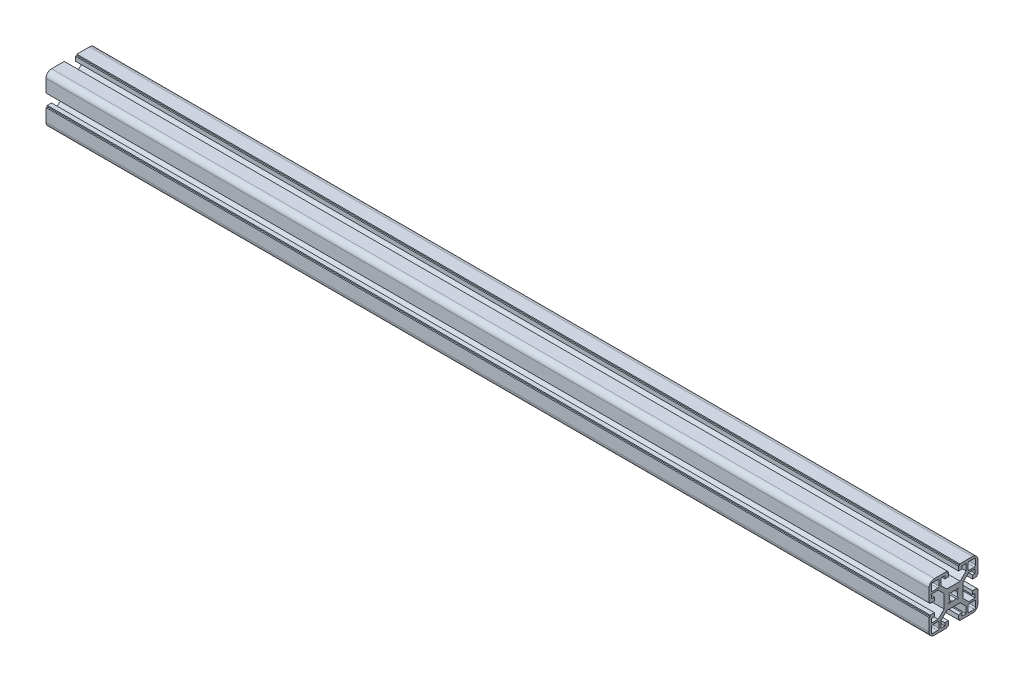
from build123d import *

# Parameters (mm, degrees)
EXTRUDE_1_DEPTH = 50
EXTRUDE_2_DEPTH = 720


with BuildPart() as part:
    # 草图1 → 凸台-拉伸1 (new body)
    with BuildSketch(Plane(origin=(0, 0, 0), x_dir=(0, 0, -1), z_dir=(1, 0, 0))):
        with BuildLine():
            Line((4.82004008, 19.27995992), (3.82004008, 19.27995992))
            Line((3.82004008, 19.27995992), (3.82004008, 15.77995992))
            Line((3.82004008, 15.77995992), (6.73639159, 15.77995992))
            Line((6.73639159, 15.77995992), (6.73639159, 18.02995992))
            Line((6.73639159, 18.02995992), (10.02004008, 18.02995992))
            Line((10.02004008, 18.02995992), (10.02004008, 12.70128026))
            Line((10.02004008, 12.70128026), (5.19871974, 7.87995992))
            Line((5.19871974, 7.87995992), (-5.75863958, 7.87995992))
            Line((-5.75863958, 7.87995992), (-10.57995992, 12.70128026))
            Line((-10.57995992, 12.70128026), (-10.57995992, 18.02995992))
            Line((-10.57995992, 18.02995992), (-7.29631143, 18.02995992))
            Line((-7.29631143, 18.02995992), (-7.29631143, 15.77995992))
            Line((-7.29631143, 15.77995992), (-4.37995992, 15.77995992))
            Line((-4.37995992, 15.77995992), (-4.37995992, 19.27995992))
            Line((-4.37995992, 19.27995992), (-5.37995992, 19.27995992))
            Line((-5.37995992, 19.27995992), (-5.37995992, 20.27995992))
            Line((-5.37995992, 20.27995992), (-15.77995992, 20.27995992))
            ThreePointArc((-15.77995992, 20.27995992), (-18.961940435, 18.961940435), (-20.27995992, 15.77995992))
            Line((-20.27995992, 15.77995992), (-20.27995992, 5.37995992))
            Line((-20.27995992, 5.37995992), (-19.27995992, 5.37995992))
            Line((-19.27995992, 5.37995992), (-19.27995992, 4.37995992))
            Line((-19.27995992, 4.37995992), (-15.77995992, 4.37995992))
            Line((-15.77995992, 4.37995992), (-15.77995992, 7.29631143))
            Line((-15.77995992, 7.29631143), (-18.02995992, 7.29631143))
            Line((-18.02995992, 7.29631143), (-18.02995992, 10.57995992))
            Line((-18.02995992, 10.57995992), (-12.70128026, 10.57995992))
            Line((-12.70128026, 10.57995992), (-7.87995992, 5.75863958))
            Line((-7.87995992, 5.75863958), (-7.87995992, -5.19871974))
            Line((-7.87995992, -5.19871974), (-12.70128026, -10.02004008))
            Line((-12.70128026, -10.02004008), (-18.02995992, -10.02004008))
            Line((-18.02995992, -10.02004008), (-18.02995992, -6.73639159))
            Line((-18.02995992, -6.73639159), (-15.77995992, -6.73639159))
            Line((-15.77995992, -6.73639159), (-15.77995992, -3.82004008))
            Line((-15.77995992, -3.82004008), (-19.27995992, -3.82004008))
            Line((-19.27995992, -3.82004008), (-19.27995992, -4.82004008))
            Line((-19.27995992, -4.82004008), (-20.27995992, -4.82004008))
            Line((-20.27995992, -4.82004008), (-20.27995992, -15.22004008))
            ThreePointArc((-20.27995992, -15.22004008), (-18.961940435, -18.402020595), (-15.77995992, -19.72004008))
            Line((-15.77995992, -19.72004008), (-5.37995992, -19.72004008))
            Line((-5.37995992, -19.72004008), (-5.37995992, -18.72004008))
            Line((-5.37995992, -18.72004008), (-4.37995992, -18.72004008))
            Line((-4.37995992, -18.72004008), (-4.37995992, -15.22004008))
            Line((-4.37995992, -15.22004008), (-7.29631143, -15.22004008))
            Line((-7.29631143, -15.22004008), (-7.29631143, -17.47004008))
            Line((-7.29631143, -17.47004008), (-10.57995992, -17.47004008))
            Line((-10.57995992, -17.47004008), (-10.57995992, -12.14136042))
            Line((-10.57995992, -12.14136042), (-5.75863958, -7.32004008))
            Line((-5.75863958, -7.32004008), (5.19871974, -7.32004008))
            Line((5.19871974, -7.32004008), (10.02004008, -12.14136042))
            Line((10.02004008, -12.14136042), (10.02004008, -17.47004008))
            Line((10.02004008, -17.47004008), (6.73639159, -17.47004008))
            Line((6.73639159, -17.47004008), (6.73639159, -15.22004008))
            Line((6.73639159, -15.22004008), (3.82004008, -15.22004008))
            Line((3.82004008, -15.22004008), (3.82004008, -18.72004008))
            Line((3.82004008, -18.72004008), (4.82004008, -18.72004008))
            Line((4.82004008, -18.72004008), (4.82004008, -19.72004008))
            Line((4.82004008, -19.72004008), (15.22004008, -19.72004008))
            ThreePointArc((15.22004008, -19.72004008), (18.402020595, -18.402020595), (19.72004008, -15.22004008))
            Line((19.72004008, -15.22004008), (19.72004008, -4.82004008))
            Line((19.72004008, -4.82004008), (18.72004008, -4.82004008))
            Line((18.72004008, -4.82004008), (18.72004008, -3.82004008))
            Line((18.72004008, -3.82004008), (15.22004008, -3.82004008))
            Line((15.22004008, -3.82004008), (15.22004008, -6.73639159))
            Line((15.22004008, -6.73639159), (17.47004008, -6.73639159))
            Line((17.47004008, -6.73639159), (17.47004008, -10.02004008))
            Line((17.47004008, -10.02004008), (12.14136042, -10.02004008))
            Line((12.14136042, -10.02004008), (7.32004008, -5.19871974))
            Line((7.32004008, -5.19871974), (7.32004008, 5.75863958))
            Line((7.32004008, 5.75863958), (12.14136042, 10.57995992))
            Line((12.14136042, 10.57995992), (17.47004008, 10.57995992))
            Line((17.47004008, 10.57995992), (17.47004008, 7.29631143))
            Line((17.47004008, 7.29631143), (15.22004008, 7.29631143))
            Line((15.22004008, 7.29631143), (15.22004008, 4.37995992))
            Line((15.22004008, 4.37995992), (18.72004008, 4.37995992))
            Line((18.72004008, 4.37995992), (18.72004008, 5.37995992))
            Line((18.72004008, 5.37995992), (19.72004008, 5.37995992))
            Line((19.72004008, 5.37995992), (19.72004008, 15.77995992))
            ThreePointArc((19.72004008, 15.77995992), (18.402020595, 18.961940435), (15.22004008, 20.27995992))
            Line((15.22004008, 20.27995992), (4.82004008, 20.27995992))
            Line((4.82004008, 20.27995992), (4.82004008, 19.27995992))
        make_face()
        with BuildLine():
            Line((-13.07995992, -17.72004008), (-17.27995992, -17.72004008))
            ThreePointArc((-17.27995992, -17.72004008), (-17.987066701, -17.427146861), (-18.27995992, -16.72004008))
            Line((-18.27995992, -16.72004008), (-18.27995992, -12.52004008))
            ThreePointArc((-18.27995992, -12.52004008), (-17.987066701, -11.812933299), (-17.27995992, -11.52004008))
            Line((-17.27995992, -11.52004008), (-13.07995992, -11.52004008))
            ThreePointArc((-13.07995992, -11.52004008), (-12.372853139, -11.812933299), (-12.07995992, -12.52004008))
            Line((-12.07995992, -12.52004008), (-12.07995992, -16.72004008))
            ThreePointArc((-12.07995992, -16.72004008), (-12.372853139, -17.427146861), (-13.07995992, -17.72004008))
        make_face(mode=Mode.SUBTRACT)
        with BuildLine():
            Line((-17.27995992, 18.27995992), (-13.07995992, 18.27995992))
            ThreePointArc((-13.07995992, 18.27995992), (-12.372853139, 17.987066701), (-12.07995992, 17.27995992))
            Line((-12.07995992, 17.27995992), (-12.07995992, 13.07995992))
            ThreePointArc((-12.07995992, 13.07995992), (-12.372853139, 12.372853139), (-13.07995992, 12.07995992))
            Line((-13.07995992, 12.07995992), (-17.27995992, 12.07995992))
            ThreePointArc((-17.27995992, 12.07995992), (-17.987066701, 12.372853139), (-18.27995992, 13.07995992))
            Line((-18.27995992, 13.07995992), (-18.27995992, 17.27995992))
            ThreePointArc((-18.27995992, 17.27995992), (-17.987066701, 17.987066701), (-17.27995992, 18.27995992))
        make_face(mode=Mode.SUBTRACT)
        with BuildLine():
            Line((16.72004008, 12.07995992), (12.52004008, 12.07995992))
            ThreePointArc((12.52004008, 12.07995992), (11.812933299, 12.372853139), (11.52004008, 13.07995992))
            Line((11.52004008, 13.07995992), (11.52004008, 17.27995992))
            ThreePointArc((11.52004008, 17.27995992), (11.812933299, 17.987066701), (12.52004008, 18.27995992))
            Line((12.52004008, 18.27995992), (16.72004008, 18.27995992))
            ThreePointArc((16.72004008, 18.27995992), (17.427146861, 17.987066701), (17.72004008, 17.27995992))
            Line((17.72004008, 17.27995992), (17.72004008, 13.07995992))
            ThreePointArc((17.72004008, 13.07995992), (17.427146861, 12.372853139), (16.72004008, 12.07995992))
        make_face(mode=Mode.SUBTRACT)
        with BuildLine():
            Line((3.75045895, -3.04335217), (3.04335217, -3.75045895))
            Line((3.04335217, -3.75045895), (1.74451108, -2.45161786))
            ThreePointArc((1.74451108, -2.45161786), (-0.27995992, -3.12004008), (-2.30443092, -2.45161786))
            Line((-2.30443092, -2.45161786), (-3.60327201, -3.75045895))
            Line((-3.60327201, -3.75045895), (-4.31037879, -3.04335217))
            Line((-4.31037879, -3.04335217), (-3.0115377, -1.74451108))
            ThreePointArc((-3.0115377, -1.74451108), (-3.67995992, 0.27995992), (-3.0115377, 2.30443092))
            Line((-3.0115377, 2.30443092), (-4.31037879, 3.60327201))
            Line((-4.31037879, 3.60327201), (-3.60327201, 4.31037879))
            Line((-3.60327201, 4.31037879), (-2.30443092, 3.0115377))
            ThreePointArc((-2.30443092, 3.0115377), (-0.27995992, 3.67995992), (1.74451108, 3.0115377))
            Line((1.74451108, 3.0115377), (3.04335217, 4.31037879))
            Line((3.04335217, 4.31037879), (3.75045895, 3.60327201))
            Line((3.75045895, 3.60327201), (2.45161786, 2.30443092))
            ThreePointArc((2.45161786, 2.30443092), (3.12004008, 0.27995992), (2.45161786, -1.74451108))
            Line((2.45161786, -1.74451108), (3.75045895, -3.04335217))
        make_face(mode=Mode.SUBTRACT)
        with BuildLine():
            Line((17.72004008, -12.52004008), (17.72004008, -16.72004008))
            ThreePointArc((17.72004008, -16.72004008), (17.427146861, -17.427146861), (16.72004008, -17.72004008))
            Line((16.72004008, -17.72004008), (12.52004008, -17.72004008))
            ThreePointArc((12.52004008, -17.72004008), (11.812933299, -17.427146861), (11.52004008, -16.72004008))
            Line((11.52004008, -16.72004008), (11.52004008, -12.52004008))
            ThreePointArc((11.52004008, -12.52004008), (11.812933299, -11.812933299), (12.52004008, -11.52004008))
            Line((12.52004008, -11.52004008), (16.72004008, -11.52004008))
            ThreePointArc((16.72004008, -11.52004008), (17.427146861, -11.812933299), (17.72004008, -12.52004008))
        make_face(mode=Mode.SUBTRACT)
    extrude(amount=-EXTRUDE_1_DEPTH)

    # 草图2 → 凸台-拉伸2 (add)
    with BuildSketch(Plane(origin=(0, 0, 0), x_dir=(0, 0, -1), z_dir=(1, 0, 0))):
        with BuildLine():
            Line((19.72004008, 5.37995992), (19.72004008, 15.77995992))
            ThreePointArc((19.72004008, 15.77995992), (18.402020595, 18.961940435), (15.22004008, 20.27995992))
            Line((15.22004008, 20.27995992), (4.82004008, 20.27995992))
            Line((4.82004008, 20.27995992), (4.82004008, 19.27995992))
            Line((4.82004008, 19.27995992), (3.82004008, 19.27995992))
            Line((3.82004008, 19.27995992), (3.82004008, 15.77995992))
            Line((3.82004008, 15.77995992), (6.73639159, 15.77995992))
            Line((6.73639159, 15.77995992), (6.73639159, 18.02995992))
            Line((6.73639159, 18.02995992), (10.02004008, 18.02995992))
            Line((10.02004008, 18.02995992), (10.02004008, 12.70128026))
            Line((10.02004008, 12.70128026), (5.19871974, 7.87995992))
            Line((5.19871974, 7.87995992), (-5.75863958, 7.87995992))
            Line((-5.75863958, 7.87995992), (-10.57995992, 12.70128026))
            Line((-10.57995992, 12.70128026), (-10.57995992, 18.02995992))
            Line((-10.57995992, 18.02995992), (-7.29631143, 18.02995992))
            Line((-7.29631143, 18.02995992), (-7.29631143, 15.77995992))
            Line((-7.29631143, 15.77995992), (-4.37995992, 15.77995992))
            Line((-4.37995992, 15.77995992), (-4.37995992, 19.27995992))
            Line((-4.37995992, 19.27995992), (-5.37995992, 19.27995992))
            Line((-5.37995992, 19.27995992), (-5.37995992, 20.27995992))
            Line((-5.37995992, 20.27995992), (-15.77995992, 20.27995992))
            ThreePointArc((-15.77995992, 20.27995992), (-18.961940435, 18.961940435), (-20.27995992, 15.77995992))
            Line((-20.27995992, 15.77995992), (-20.27995992, 5.37995992))
            Line((-20.27995992, 5.37995992), (-19.27995992, 5.37995992))
            Line((-19.27995992, 5.37995992), (-19.27995992, 4.37995992))
            Line((-19.27995992, 4.37995992), (-15.77995992, 4.37995992))
            Line((-15.77995992, 4.37995992), (-15.77995992, 7.29631143))
            Line((-15.77995992, 7.29631143), (-18.02995992, 7.29631143))
            Line((-18.02995992, 7.29631143), (-18.02995992, 10.57995992))
            Line((-18.02995992, 10.57995992), (-12.70128026, 10.57995992))
            Line((-12.70128026, 10.57995992), (-7.87995992, 5.75863958))
            Line((-7.87995992, 5.75863958), (-7.87995992, -5.19871974))
            Line((-7.87995992, -5.19871974), (-12.70128026, -10.02004008))
            Line((-12.70128026, -10.02004008), (-18.02995992, -10.02004008))
            Line((-18.02995992, -10.02004008), (-18.02995992, -6.73639159))
            Line((-18.02995992, -6.73639159), (-15.77995992, -6.73639159))
            Line((-15.77995992, -6.73639159), (-15.77995992, -3.82004008))
            Line((-15.77995992, -3.82004008), (-19.27995992, -3.82004008))
            Line((-19.27995992, -3.82004008), (-19.27995992, -4.82004008))
            Line((-19.27995992, -4.82004008), (-20.27995992, -4.82004008))
            Line((-20.27995992, -4.82004008), (-20.27995992, -15.22004008))
            ThreePointArc((-20.27995992, -15.22004008), (-18.961940435, -18.402020595), (-15.77995992, -19.72004008))
            Line((-15.77995992, -19.72004008), (-5.37995992, -19.72004008))
            Line((-5.37995992, -19.72004008), (-5.37995992, -18.72004008))
            Line((-5.37995992, -18.72004008), (-4.37995992, -18.72004008))
            Line((-4.37995992, -18.72004008), (-4.37995992, -15.22004008))
            Line((-4.37995992, -15.22004008), (-7.29631143, -15.22004008))
            Line((-7.29631143, -15.22004008), (-7.29631143, -17.47004008))
            Line((-7.29631143, -17.47004008), (-10.57995992, -17.47004008))
            Line((-10.57995992, -17.47004008), (-10.57995992, -12.14136042))
            Line((-10.57995992, -12.14136042), (-5.75863958, -7.32004008))
            Line((-5.75863958, -7.32004008), (5.19871974, -7.32004008))
            Line((5.19871974, -7.32004008), (10.02004008, -12.14136042))
            Line((10.02004008, -12.14136042), (10.02004008, -17.47004008))
            Line((10.02004008, -17.47004008), (6.73639159, -17.47004008))
            Line((6.73639159, -17.47004008), (6.73639159, -15.22004008))
            Line((6.73639159, -15.22004008), (3.82004008, -15.22004008))
            Line((3.82004008, -15.22004008), (3.82004008, -18.72004008))
            Line((3.82004008, -18.72004008), (4.82004008, -18.72004008))
            Line((4.82004008, -18.72004008), (4.82004008, -19.72004008))
            Line((4.82004008, -19.72004008), (15.22004008, -19.72004008))
            ThreePointArc((15.22004008, -19.72004008), (18.402020595, -18.402020595), (19.72004008, -15.22004008))
            Line((19.72004008, -15.22004008), (19.72004008, -4.82004008))
            Line((19.72004008, -4.82004008), (18.72004008, -4.82004008))
            Line((18.72004008, -4.82004008), (18.72004008, -3.82004008))
            Line((18.72004008, -3.82004008), (15.22004008, -3.82004008))
            Line((15.22004008, -3.82004008), (15.22004008, -6.73639159))
            Line((15.22004008, -6.73639159), (17.47004008, -6.73639159))
            Line((17.47004008, -6.73639159), (17.47004008, -10.02004008))
            Line((17.47004008, -10.02004008), (12.14136042, -10.02004008))
            Line((12.14136042, -10.02004008), (7.32004008, -5.19871974))
            Line((7.32004008, -5.19871974), (7.32004008, 5.75863958))
            Line((7.32004008, 5.75863958), (12.14136042, 10.57995992))
            Line((12.14136042, 10.57995992), (17.47004008, 10.57995992))
            Line((17.47004008, 10.57995992), (17.47004008, 7.29631143))
            Line((17.47004008, 7.29631143), (15.22004008, 7.29631143))
            Line((15.22004008, 7.29631143), (15.22004008, 4.37995992))
            Line((15.22004008, 4.37995992), (18.72004008, 4.37995992))
            Line((18.72004008, 4.37995992), (18.72004008, 5.37995992))
            Line((18.72004008, 5.37995992), (19.72004008, 5.37995992))
        make_face()
        with BuildLine():
            Line((-17.27995992, -17.72004008), (-13.07995992, -17.72004008))
            ThreePointArc((-13.07995992, -17.72004008), (-12.372853139, -17.427146861), (-12.07995992, -16.72004008))
            Line((-12.07995992, -16.72004008), (-12.07995992, -12.52004008))
            ThreePointArc((-12.07995992, -12.52004008), (-12.372853139, -11.812933299), (-13.07995992, -11.52004008))
            Line((-13.07995992, -11.52004008), (-17.27995992, -11.52004008))
            ThreePointArc((-17.27995992, -11.52004008), (-17.987066701, -11.812933299), (-18.27995992, -12.52004008))
            Line((-18.27995992, -12.52004008), (-18.27995992, -16.72004008))
            ThreePointArc((-18.27995992, -16.72004008), (-17.987066701, -17.427146861), (-17.27995992, -17.72004008))
        make_face(mode=Mode.SUBTRACT)
        with BuildLine():
            Line((-13.07995992, 18.27995992), (-17.27995992, 18.27995992))
            ThreePointArc((-17.27995992, 18.27995992), (-17.987066701, 17.987066701), (-18.27995992, 17.27995992))
            Line((-18.27995992, 17.27995992), (-18.27995992, 13.07995992))
            ThreePointArc((-18.27995992, 13.07995992), (-17.987066701, 12.372853139), (-17.27995992, 12.07995992))
            Line((-17.27995992, 12.07995992), (-13.07995992, 12.07995992))
            ThreePointArc((-13.07995992, 12.07995992), (-12.372853139, 12.372853139), (-12.07995992, 13.07995992))
            Line((-12.07995992, 13.07995992), (-12.07995992, 17.27995992))
            ThreePointArc((-12.07995992, 17.27995992), (-12.372853139, 17.987066701), (-13.07995992, 18.27995992))
        make_face(mode=Mode.SUBTRACT)
        with BuildLine():
            Line((11.52004008, 17.27995992), (11.52004008, 13.07995992))
            ThreePointArc((11.52004008, 13.07995992), (11.812933299, 12.372853139), (12.52004008, 12.07995992))
            Line((12.52004008, 12.07995992), (16.72004008, 12.07995992))
            ThreePointArc((16.72004008, 12.07995992), (17.427146861, 12.372853139), (17.72004008, 13.07995992))
            Line((17.72004008, 13.07995992), (17.72004008, 17.27995992))
            ThreePointArc((17.72004008, 17.27995992), (17.427146861, 17.987066701), (16.72004008, 18.27995992))
            Line((16.72004008, 18.27995992), (12.52004008, 18.27995992))
            ThreePointArc((12.52004008, 18.27995992), (11.812933299, 17.987066701), (11.52004008, 17.27995992))
        make_face(mode=Mode.SUBTRACT)
        with BuildLine():
            Line((11.52004008, -12.52004008), (11.52004008, -16.72004008))
            ThreePointArc((11.52004008, -16.72004008), (11.812933299, -17.427146861), (12.52004008, -17.72004008))
            Line((12.52004008, -17.72004008), (16.72004008, -17.72004008))
            ThreePointArc((16.72004008, -17.72004008), (17.427146861, -17.427146861), (17.72004008, -16.72004008))
            Line((17.72004008, -16.72004008), (17.72004008, -12.52004008))
            ThreePointArc((17.72004008, -12.52004008), (17.427146861, -11.812933299), (16.72004008, -11.52004008))
            Line((16.72004008, -11.52004008), (12.52004008, -11.52004008))
            ThreePointArc((12.52004008, -11.52004008), (11.812933299, -11.812933299), (11.52004008, -12.52004008))
        make_face(mode=Mode.SUBTRACT)
        with BuildLine():
            Line((-4.31037879, 3.60327201), (-3.0115377, 2.30443092))
            ThreePointArc((-3.0115377, 2.30443092), (-3.67995992, 0.27995992), (-3.0115377, -1.74451108))
            Line((-3.0115377, -1.74451108), (-4.31037879, -3.04335217))
            Line((-4.31037879, -3.04335217), (-3.60327201, -3.75045895))
            Line((-3.60327201, -3.75045895), (-2.30443092, -2.45161786))
            ThreePointArc((-2.30443092, -2.45161786), (-0.27995992, -3.12004008), (1.74451108, -2.45161786))
            Line((1.74451108, -2.45161786), (3.04335217, -3.75045895))
            Line((3.04335217, -3.75045895), (3.75045895, -3.04335217))
            Line((3.75045895, -3.04335217), (2.45161786, -1.74451108))
            ThreePointArc((2.45161786, -1.74451108), (3.12004008, 0.27995992), (2.45161786, 2.30443092))
            Line((2.45161786, 2.30443092), (3.75045895, 3.60327201))
            Line((3.75045895, 3.60327201), (3.04335217, 4.31037879))
            Line((3.04335217, 4.31037879), (1.74451108, 3.0115377))
            ThreePointArc((1.74451108, 3.0115377), (-0.27995992, 3.67995992), (-2.30443092, 3.0115377))
            Line((-2.30443092, 3.0115377), (-3.60327201, 4.31037879))
            Line((-3.60327201, 4.31037879), (-4.31037879, 3.60327201))
        make_face(mode=Mode.SUBTRACT)
    extrude(amount=-EXTRUDE_2_DEPTH)


solid = part.part
